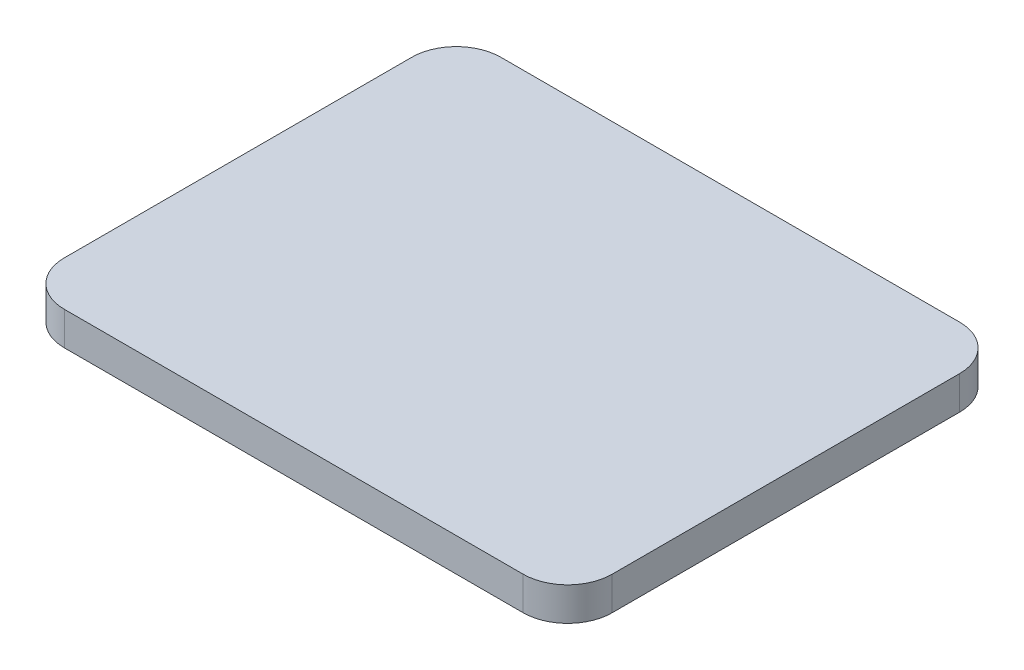
from build123d import *

# Parameters (mm, degrees)
SKETCH1_W           = 62.484
SKETCH1_H           = 49.784
BOSS_EXTRUDE1_DEPTH = 3.81
SKETCH2_W           = 54.61
SKETCH2_H           = 41.91
SKETCH2_W_2         = 49.53
SKETCH2_H_2         = 36.83
BOSS_EXTRUDE3_DEPTH = 3.81
FILLET1_R           = 5.08
FILLET2_R           = 5.08
FILLET3_R           = 2.54


with BuildPart() as part:
    # Sketch1 → Boss-Extrude1 (new body)
    with BuildSketch(Plane(origin=(0, 0, 0), x_dir=(1, 0, 0), z_dir=(0, 1, 0))):
        with Locations((31.242, -24.892)):
            Rectangle(SKETCH1_W, SKETCH1_H)
    extrude(amount=BOSS_EXTRUDE1_DEPTH)

    # Sketch2 → Boss-Extrude3 (add)
    with BuildSketch(Plane.XZ):
        with Locations((31.242, 24.892)):
            Rectangle(SKETCH2_W, SKETCH2_H)
        with Locations((31.242, 24.892)):
            Rectangle(SKETCH2_W_2, SKETCH2_H_2, mode=Mode.SUBTRACT)
    extrude(amount=BOSS_EXTRUDE3_DEPTH)

    # Fillet1
    fillet1_edges = [part.edges().sort_by_distance(p)[0] for p in [
        (0, 1.905, 49.784),
        (0, 1.905, 0),
        (62.484, 1.905, 0),
        (62.484, 1.905, 49.784),
    ]]
    fillet(fillet1_edges, radius=FILLET1_R)

    # Fillet2
    fillet2_edges = [part.edges().sort_by_distance(p)[0] for p in [
        (58.547, -1.905, 3.937),
        (58.547, -1.905, 45.847),
        (3.937, -1.905, 45.847),
        (3.937, -1.905, 3.937),
    ]]
    fillet(fillet2_edges, radius=FILLET2_R)

    # Fillet3
    fillet3_edges = [part.edges().sort_by_distance(p)[0] for p in [
        (56.007, -1.905, 43.307),
        (6.477, -1.905, 43.307),
        (6.477, -1.905, 6.477),
        (56.007, -1.905, 6.477),
    ]]
    fillet(fillet3_edges, radius=FILLET3_R)


solid = part.part
